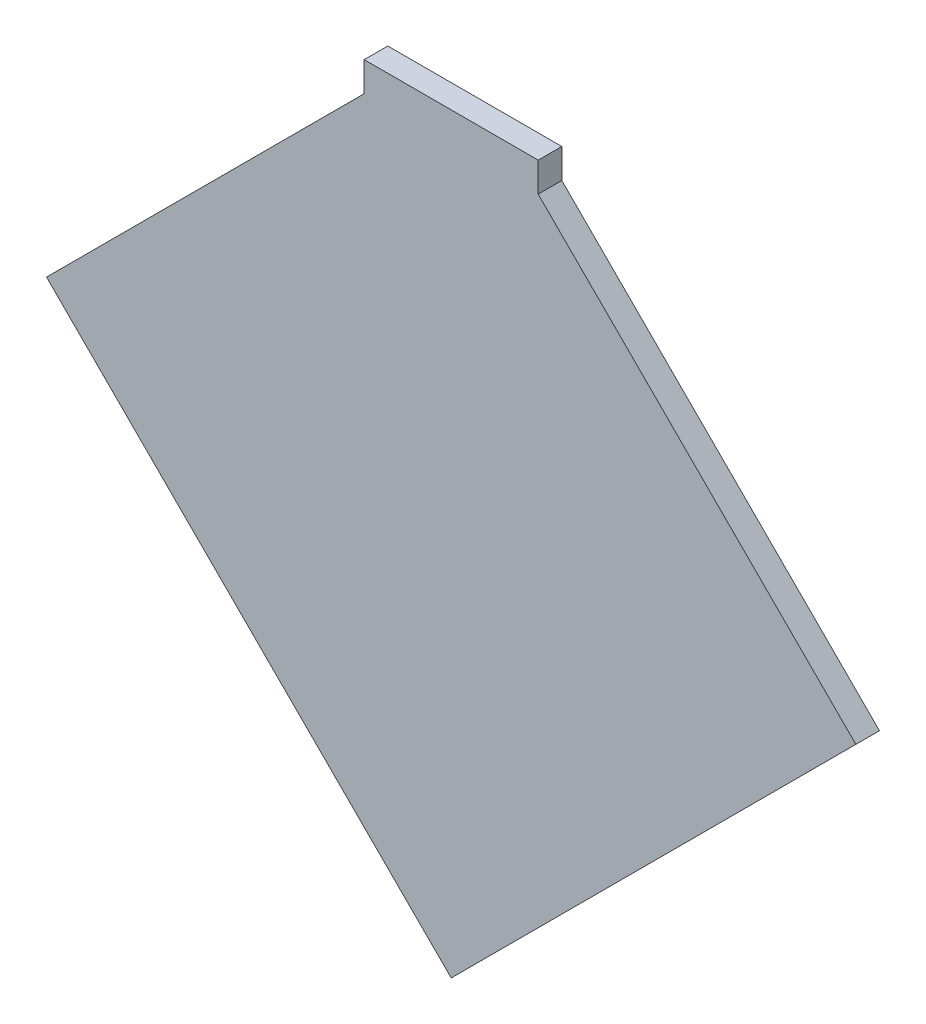
from build123d import *

# Parameters (mm, degrees)
BOSS_EXTRUDE1_DEPTH = 1.2
SKETCH2_W           = 8.848528138
SKETCH2_H           = 1.5
BOSS_EXTRUDE2_DEPTH = 1.2


with BuildPart() as part:
    # Sketch1 → Boss-Extrude1 (new body)
    with BuildSketch(Plane.XY):
        Polygon((4, 16.152543264), (-4, 16.152543264), (-20.152543264, 0), (0, -20.152543264), (20.152543264, 0), align=None)
        Polygon((-4.424264069, 16.152543264), (-4.624264069, 15.952543264), (-4.482842712, 15.952543264), (-20.435385976, 0), (0, -20.435385976), (20.435385976, 0), (4.482842712, 15.952543264), (4.624264069, 15.952543264), (4.424264069, 16.152543264), (4, 16.152543264), (20.152543264, 0), (0, -20.152543264), (-20.152543264, 0), (-4, 16.152543264), align=None)
        Polygon((-20.435385976, 0), (-4.482842712, 15.952543264), (-4.624264069, 15.952543264), (-20.576807333, 0), (0, -20.576807333), (20.576807333, 0), (4.624264069, 15.952543264), (4.482842712, 15.952543264), (20.435385976, 0), (0, -20.435385976), align=None)
    extrude(amount=BOSS_EXTRUDE1_DEPTH)

    # Sketch2 → Boss-Extrude2 (add)
    with BuildSketch(Plane.XY):
        with Locations((0, 16.902543264)):
            Rectangle(SKETCH2_W, SKETCH2_H)
    extrude(amount=BOSS_EXTRUDE2_DEPTH)


solid = part.part
